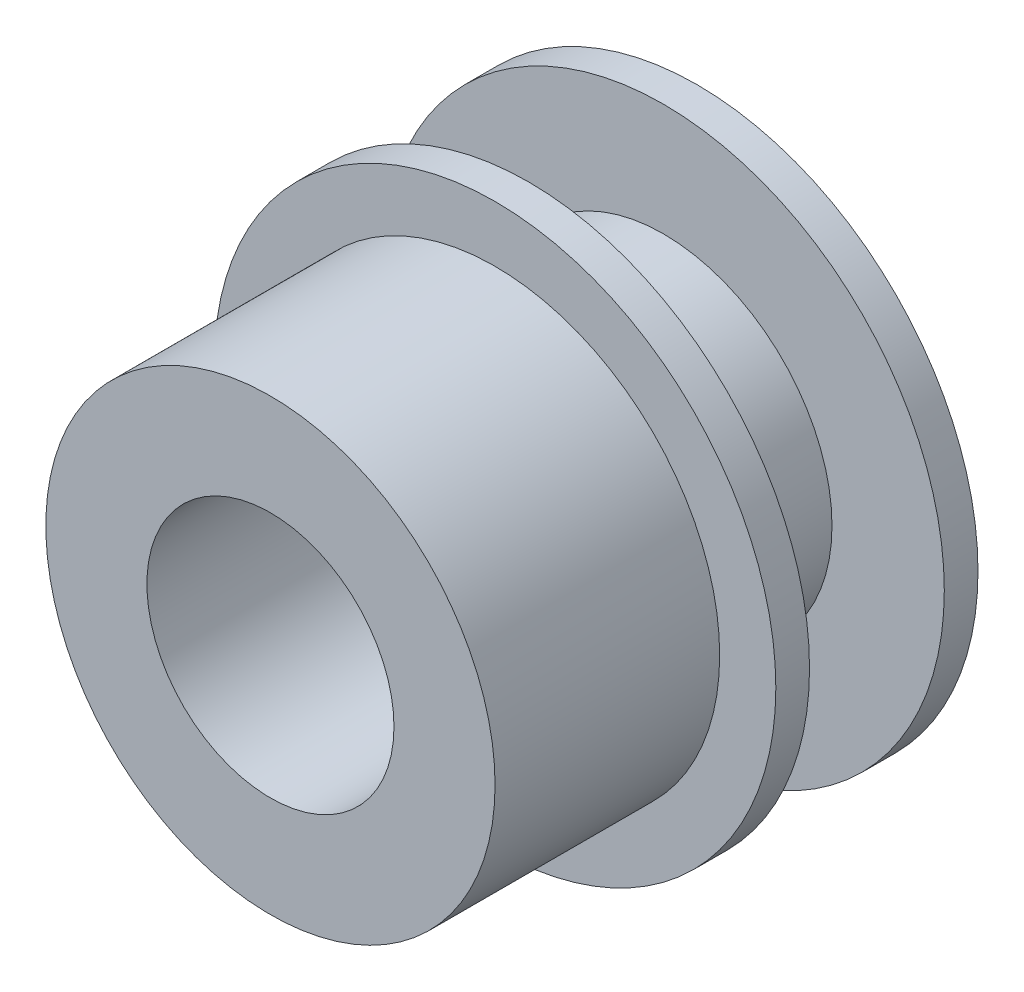
from build123d import *

# Parameters (mm, degrees)
SKETCH1_R           = 25
BOSS_EXTRUDE1_DEPTH = 3
SKETCH2_R           = 15
BOSS_EXTRUDE2_DEPTH = 15
SKETCH3_R           = 25
BOSS_EXTRUDE3_DEPTH = 3
SKETCH4_R           = 20
BOSS_EXTRUDE4_DEPTH = 20
SKETCH5_R           = 11
CUT_EXTRUDE1_DEPTH  = 50


with BuildPart() as part:
    # Sketch1 → Boss-Extrude1 (new body)
    with BuildSketch(Plane.XY):
        Circle(SKETCH1_R)
    extrude(amount=BOSS_EXTRUDE1_DEPTH)

    # Sketch2 → Boss-Extrude2 (add)
    with BuildSketch(Plane.XY):
        Circle(SKETCH2_R)
    extrude(amount=BOSS_EXTRUDE2_DEPTH)

    # Sketch3 → Boss-Extrude3 (add)
    with BuildSketch(Plane.XY.offset(15)):
        Circle(SKETCH3_R)
    extrude(amount=BOSS_EXTRUDE3_DEPTH)

    # Sketch4 → Boss-Extrude4 (add)
    with BuildSketch(Plane.XY.offset(18)):
        Circle(SKETCH4_R)
    extrude(amount=BOSS_EXTRUDE4_DEPTH)

    # Sketch5 → Cut-Extrude1 (cut)
    with BuildSketch(Plane.XY.offset(38)):
        Circle(SKETCH5_R)
    extrude(amount=-CUT_EXTRUDE1_DEPTH, mode=Mode.SUBTRACT)


solid = part.part
